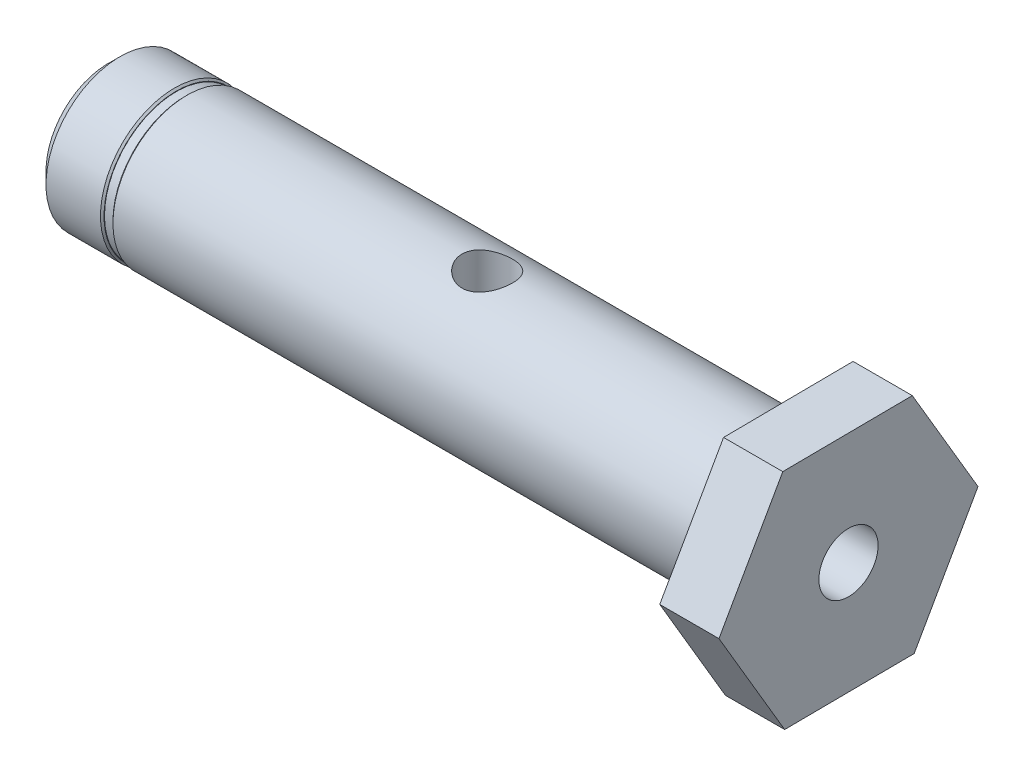
from build123d import *

# Parameters (mm, degrees)
SKETCH1_R                 = 12.5
BOSS_EXTRUDE1_DEPTH       = 115
CHAMFER1_SIZE             = 2
BOSS_EXTRUDE2_DEPTH       = 10
F_8_0MM_DOWEL_HOLE1_D     = 8.5
F_8_0MM_DOWEL_HOLE1_DEPTH = 70
F_8_0MM_DOWEL_HOLE1_TIP   = 2.553657631
CUT_EXTRUDE1_START        = -13
SKETCH7_R                 = 5
SKETCH7_R_2               = 4.25
CUT_EXTRUDE1_DEPTH        = 13
CUT_EXTRUDE2_DEPTH        = 129.317659161
CUT_EXTRUDE2_DEPTH_BACK   = 129.317659161
SKETCH10_R                = 4.25
SKETCH11_W                = 1.5
SKETCH11_H                = 4.762269722
CHAMFER2_SIZE             = 0.3
CHAMFER3_SIZE             = 0.3


with BuildPart() as part:
    # Sketch1 → Boss-Extrude1 (new body)
    with BuildSketch(Plane(origin=(0, 0, 0), x_dir=(0, 0, -1), z_dir=(1, 0, 0))):
        Circle(SKETCH1_R)
    extrude(amount=BOSS_EXTRUDE1_DEPTH)

    # Chamfer1
    chamfer1_edges = [part.edges().sort_by_distance(p)[0] for p in [
        (0, 0, 12.5),
    ]]
    chamfer(chamfer1_edges, length=CHAMFER1_SIZE)

    # Sketch3 → Boss-Extrude2 (add)
    with BuildSketch(Plane(origin=(115, 0, 0), x_dir=(0, 0, -1), z_dir=(1, 0, 0))):
        Polygon((11.093502405, -18.847185944), (21.86889302, 0.183661927), (10.775390615, 19.030847871), (-11.093502405, 18.847185944), (-21.86889302, -0.183661927), (-10.775390615, -19.030847871), align=None)
    extrude(amount=BOSS_EXTRUDE2_DEPTH)

    # Ø8.0mm Dowel Hole1
    with Locations(Plane(origin=(125, 0, 0), x_dir=(0, 0, -1), z_dir=(1, 0, 0))):
        with Locations((0, 0)):
            Hole(F_8_0MM_DOWEL_HOLE1_D / 2, depth=F_8_0MM_DOWEL_HOLE1_DEPTH)
            with Locations((0, 0, -(F_8_0MM_DOWEL_HOLE1_DEPTH + F_8_0MM_DOWEL_HOLE1_TIP / 2))):  # 118° drill point
                Cone(0, F_8_0MM_DOWEL_HOLE1_D / 2, F_8_0MM_DOWEL_HOLE1_TIP, mode=Mode.SUBTRACT)

    # Sketch7 → Cut-Extrude1 (cut)
    with BuildSketch(Plane(origin=(125, 0, 0), x_dir=(0, 0, -1), z_dir=(1, 0, 0)).offset(CUT_EXTRUDE1_START)):
        Circle(SKETCH7_R)
        Circle(SKETCH7_R_2, mode=Mode.SUBTRACT)
    extrude(amount=CUT_EXTRUDE1_DEPTH, mode=Mode.SUBTRACT)

    # Sketch10 → Cut-Extrude2 (cut, two sides: drawn at the far end of the back side and taken through both)
    with BuildSketch(Plane(origin=(0, 0, 0), x_dir=(1, 0, 0), z_dir=(0, 1, 0)).offset(-CUT_EXTRUDE2_DEPTH_BACK)):
        with Locations(Location((64, 0, 0), (0, 0, 270))):
            Circle(SKETCH10_R)
    extrude(amount=CUT_EXTRUDE2_DEPTH + CUT_EXTRUDE2_DEPTH_BACK, mode=Mode.SUBTRACT)

    # Sketch11 → Cut-Revolve3 (revolve, cut)
    with BuildSketch(Plane.XY, mode=Mode.PRIVATE) as cut_revolve3_sk:
        with Locations((12.25, 14.506134861)):
            Rectangle(SKETCH11_W, SKETCH11_H)
    revolve(cut_revolve3_sk.sketch.rotate(Axis((-5.779414499, 0, 0), (1, 0, 0)), 270), axis=Axis((-5.779414499, 0, 0), (1, 0, 0)), mode=Mode.SUBTRACT)

    # Chamfer2
    chamfer2_edges = [part.edges().sort_by_distance(p)[0] for p in [
        (13, 0, 12.5),
    ]]
    chamfer(chamfer2_edges, length=CHAMFER2_SIZE)

    # Chamfer3
    chamfer3_edges = [part.edges().sort_by_distance(p)[0] for p in [
        (11.5, 0, 12.5),
    ]]
    chamfer(chamfer3_edges, length=CHAMFER3_SIZE)


solid = part.part
